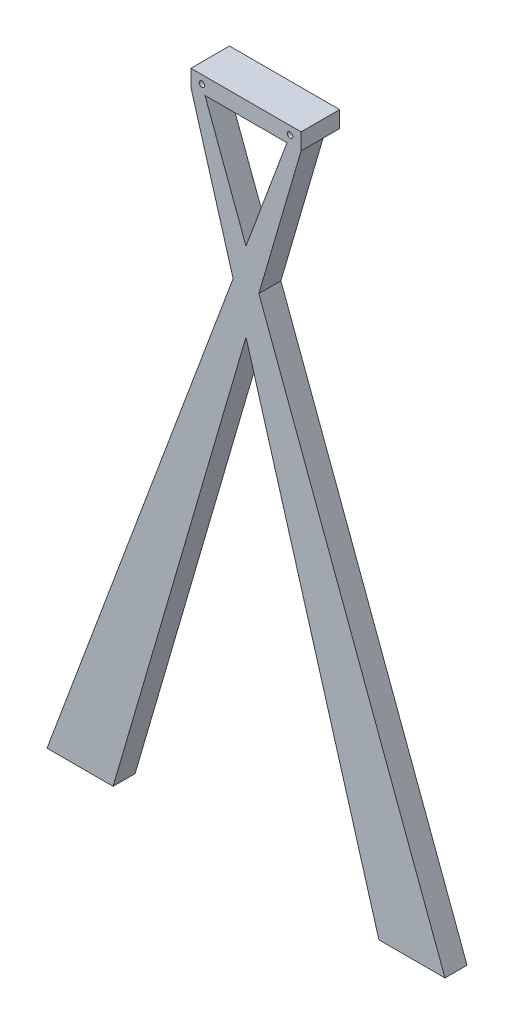
from build123d import *

# Parameters (mm, degrees)
SKETCH1_R           = 0.125
BOSS_EXTRUDE1_DEPTH = 1
SCALE1_SCALE        = 25.399986
BOSS_EXTRUDE2_START = 19.05
SKETCH2_W           = 126.99993
SKETCH2_H           = 19.0499895
SKETCH2_R           = 3.17499825
BOSS_EXTRUDE2_DEPTH = 19.05


with BuildPart() as part:
    # Sketch1 → Boss-Extrude1 (new body)
    with BuildSketch(Plane.XY):
        Polygon((6.53415074, 29.25), (8.449452651, 22.685482615), (0, 0), (3, 0), (9.03415074, 20.681484839), (15.06830148, 0), (18.06830148, 0), (9.618848829, 22.685482615), (11.53415074, 29.25), (11.53415074, 30), (6.53415074, 30), align=None)
        Polygon((7.173823534, 29.25), (10.894477946, 29.25), (9.03415074, 24.25530718), align=None, mode=Mode.SUBTRACT)
        with Locations((7.03415074, 29.625)):
            Circle(SKETCH1_R, mode=Mode.SUBTRACT)
        with Locations((11.03415074, 29.625)):
            Circle(SKETCH1_R, mode=Mode.SUBTRACT)
    extrude(amount=BOSS_EXTRUDE1_DEPTH)


with BuildPart() as part_1:
    # Scale1: scaled about (9.03415074, 11.863251785, 0.5)
    add(part.part.scale(SCALE1_SCALE).moved(Location((-220.433151578, -289.463177468, -12.199993))))

    # Sketch2 → Boss-Extrude2 (add)
    with BuildSketch(Plane(origin=(0, 0, -12.199993), x_dir=(-1, 0, 0), z_dir=(0, 0, -1)).offset(BOSS_EXTRUDE2_START)):
        with Locations((-9.03415074, 463.011407788)):
            Rectangle(SKETCH2_W, SKETCH2_H)
        with Locations((-59.83412274, 463.011407788)):
            Circle(SKETCH2_R, mode=Mode.SUBTRACT)
        with Locations((41.76582126, 463.011407788)):
            Circle(SKETCH2_R, mode=Mode.SUBTRACT)
    extrude(amount=-BOSS_EXTRUDE2_DEPTH)


solid = part_1.part
